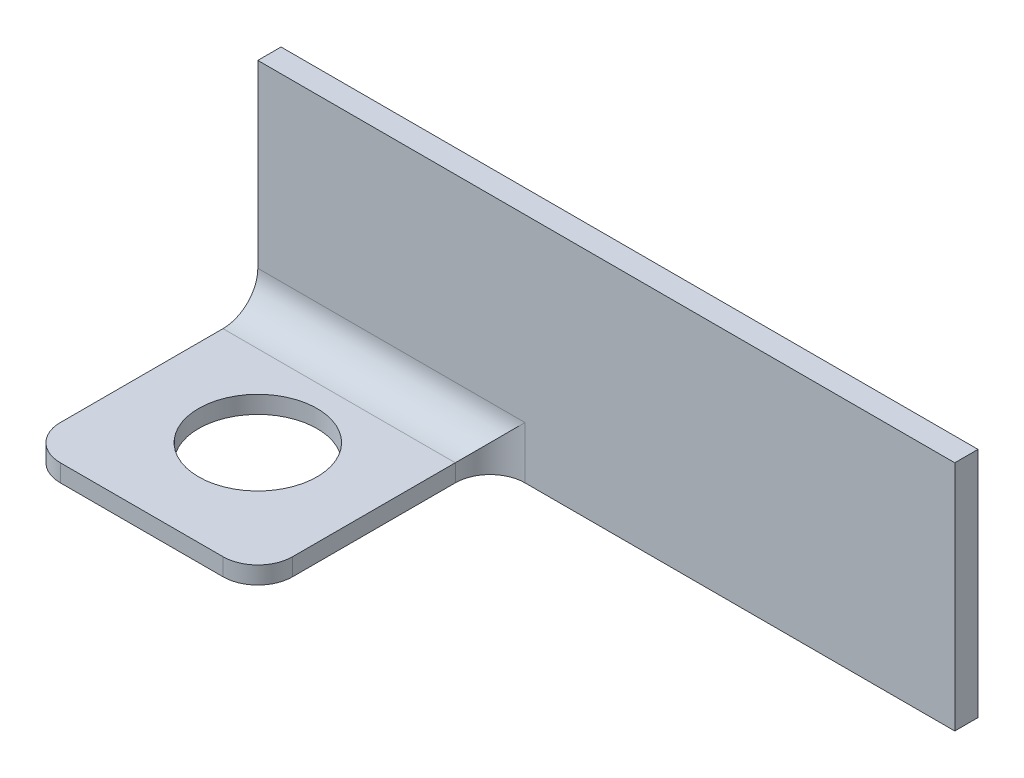
from build123d import *

# Parameters (mm, degrees)
SKETCH1_W           = 20
SKETCH1_H           = 20
SKETCH1_R           = 5.1
BOSS_EXTRUDE2_DEPTH = 1.5
SKETCH1_4_W         = 60
SKETCH1_4_H         = 2
BOSS_EXTRUDE3_DEPTH = 20
FILLET1_R           = 3
FILLET2_R           = 3
FILLET3_R           = 3


with BuildPart() as part:
    # Sketch1 → Boss-Extrude2 (new body)
    with BuildSketch(Plane(origin=(0, 0, 0), x_dir=(1, 0, 0), z_dir=(0, 1, 0))):
        Rectangle(SKETCH1_W, SKETCH1_H)
        Circle(SKETCH1_R, mode=Mode.SUBTRACT)
    extrude(amount=BOSS_EXTRUDE2_DEPTH)

    # Sketch1<4> → Boss-Extrude3 (add)
    with BuildSketch(Plane(origin=(0, 0, 0), x_dir=(1, 0, 0), z_dir=(0, 1, 0))):
        with Locations((20, 11)):
            Rectangle(SKETCH1_4_W, SKETCH1_4_H)
    extrude(amount=BOSS_EXTRUDE3_DEPTH)

    # Fillet1
    fillet1_edges = [part.edges().sort_by_distance(p)[0] for p in [
        (0, 1.5, -10),
    ]]
    fillet(fillet1_edges, radius=FILLET1_R)

    # Fillet2
    fillet2_edges = [part.edges().sort_by_distance(p)[0] for p in [
        (10, 2.25, -10),
    ]]
    fillet(fillet2_edges, radius=FILLET2_R)

    # Fillet3
    fillet3_edges = [part.edges().sort_by_distance(p)[0] for p in [
        (10, 0.75, 10),
        (-10, 0.75, 10),
    ]]
    fillet(fillet3_edges, radius=FILLET3_R)


solid = part.part
